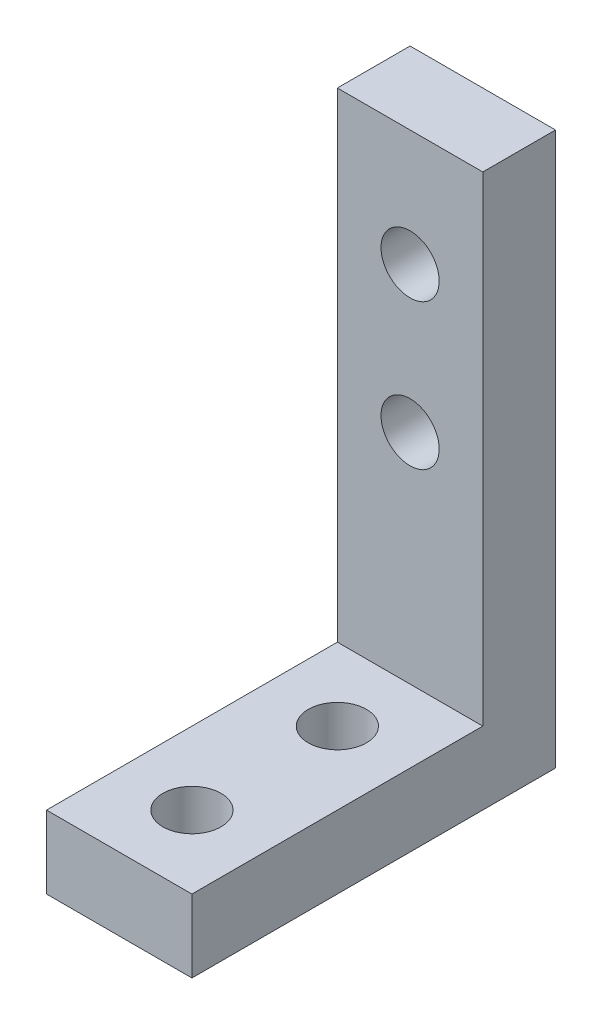
from build123d import *

# Parameters (mm, degrees)
SKETCH2_W           = 10
SKETCH2_H           = 25
BOSS_EXTRUDE1_DEPTH = 5
SKETCH4_W           = 10
SKETCH4_H           = 5
BOSS_EXTRUDE2_DEPTH = 33
SKETCH6_R           = 2
CUT_EXTRUDE1_DEPTH  = 36.640566774
SKETCH7_R           = 2
CUT_EXTRUDE2_DEPTH  = 44.231932642


with BuildPart() as part:
    # Sketch2 → Boss-Extrude1 (new body)
    with BuildSketch(Plane(origin=(0, 0, 0), x_dir=(1, 0, 0), z_dir=(0, 1, 0))):
        Rectangle(SKETCH2_W, SKETCH2_H)
    extrude(amount=BOSS_EXTRUDE1_DEPTH)

    # Sketch4 → Boss-Extrude2 (add)
    with BuildSketch(Plane(origin=(0, 5, 0), x_dir=(1, 0, 0), z_dir=(0, 1, 0))):
        with Locations((0, 10)):
            Rectangle(SKETCH4_W, SKETCH4_H)
    extrude(amount=BOSS_EXTRUDE2_DEPTH)

    # Sketch6 → Cut-Extrude1 (cut, through all)
    with BuildSketch(Plane(origin=(0, 5, 0), x_dir=(1, 0, 0), z_dir=(0, 1, 0))):
        with Locations(Location((0, 2.5, 0), (0, 0, 270))):
            Circle(SKETCH6_R)
        with Locations(Location((0, -7.5, 0), (0, 0, 270))):
            Circle(SKETCH6_R)
    extrude(amount=-CUT_EXTRUDE1_DEPTH, mode=Mode.SUBTRACT)

    # Sketch7 → Cut-Extrude2 (cut, through all)
    with BuildSketch(Plane.XY.offset(-7.5)):
        with Locations((0, 30)):
            Circle(SKETCH7_R)
        with Locations((0, 20)):
            Circle(SKETCH7_R)
    extrude(amount=-CUT_EXTRUDE2_DEPTH, mode=Mode.SUBTRACT)


solid = part.part
